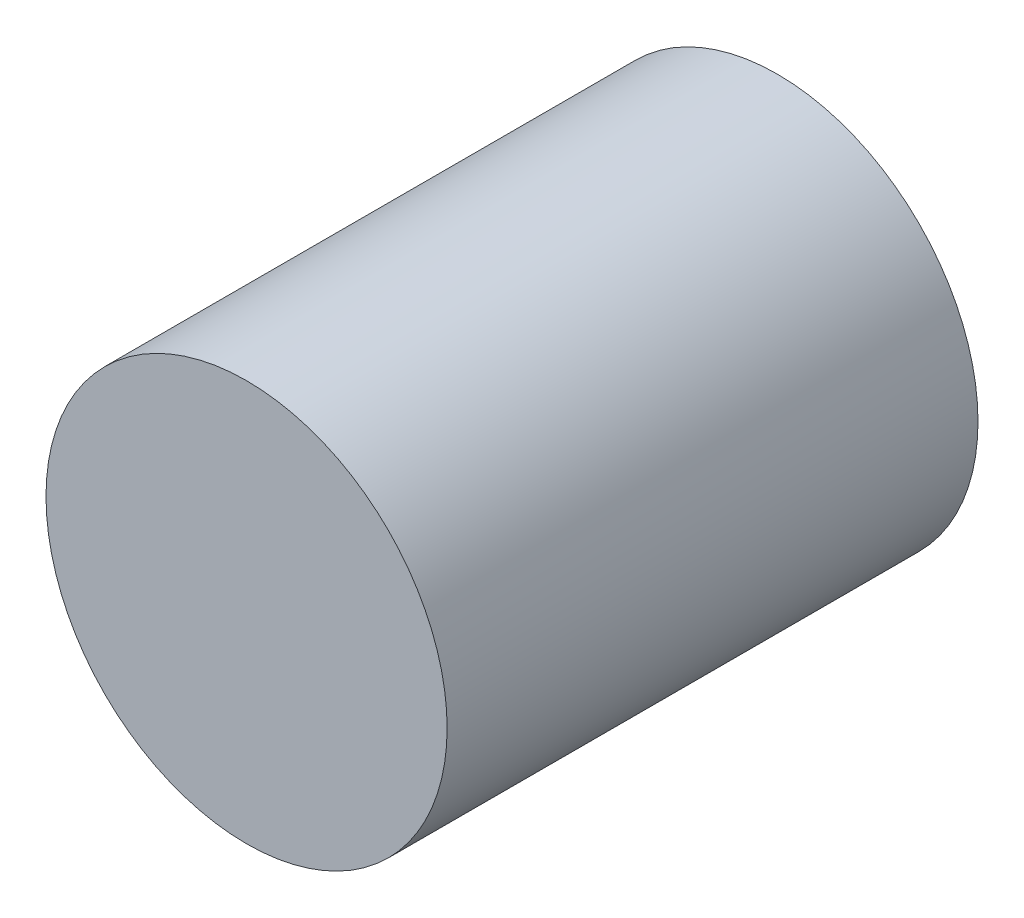
from build123d import *

# Parameters (mm, degrees)
SKETCH1_R           = 37.780743532
BOSS_EXTRUDE1_DEPTH = 100


with BuildPart() as part:
    # Sketch1 → Boss-Extrude1 (new body)
    with BuildSketch(Plane.XY):
        Circle(SKETCH1_R)
    extrude(amount=BOSS_EXTRUDE1_DEPTH)


solid = part.part
